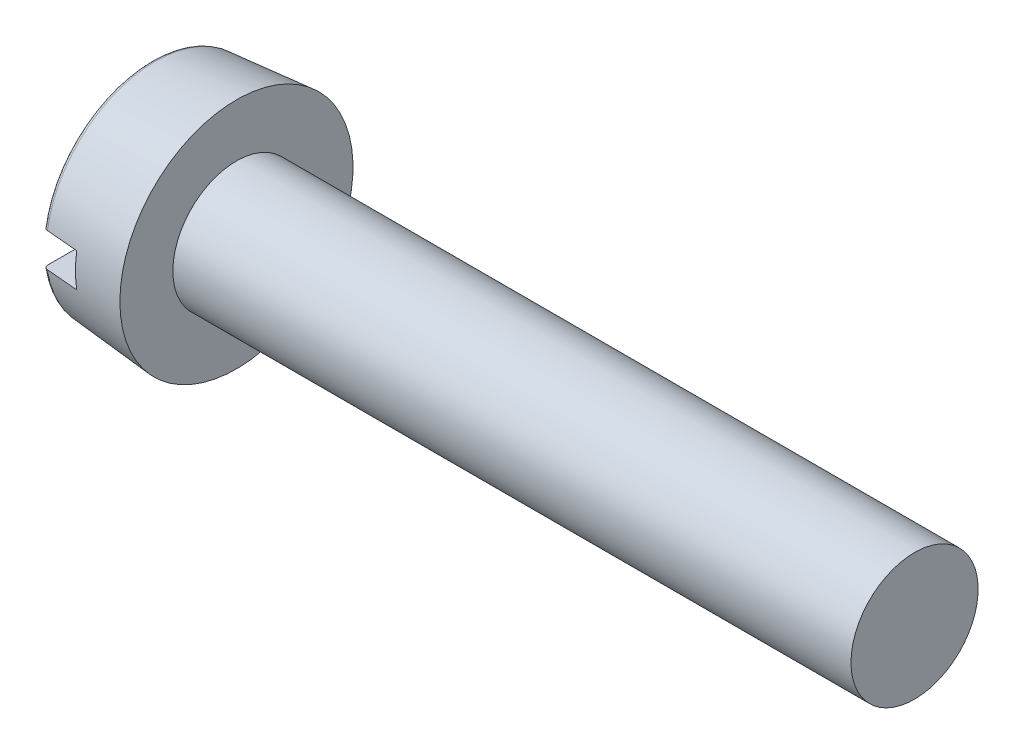
from build123d import *

# Parameters (mm, degrees)
FILLET2_R  = 0.1
SKETCH2_W  = 5.5
SKETCH2_H  = 0.8
SLOT_DEPTH = 0.85


with BuildPart() as part:
    # BodySke → Base-Revolve (revolve)
    with BuildSketch(Plane.XY, mode=Mode.PRIVATE) as base_revolve_sk:
        Polygon((2, 1.5), (2, 2.75), (0, 2.575022673), (0, 0), (18, 0), (18, 1.5), align=None)
    revolve(base_revolve_sk.sketch.rotate(Axis((-25.4, 0, 0), (1, 0, 0)), 90), axis=Axis((-25.4, 0, 0), (1, 0, 0)))

    # Fillet2
    fillet2_edges = [part.edges().sort_by_distance(p)[0] for p in [
        (0, 0, -2.575022673),
    ]]
    fillet(fillet2_edges, radius=FILLET2_R)

    # Sketch2 → Slot (cut)
    with BuildSketch(Plane(origin=(0, 0, 0), x_dir=(0, 0, -1), z_dir=(1, 0, 0))):
        Rectangle(SKETCH2_W, SKETCH2_H)
    extrude(amount=SLOT_DEPTH, mode=Mode.SUBTRACT)


solid = part.part
